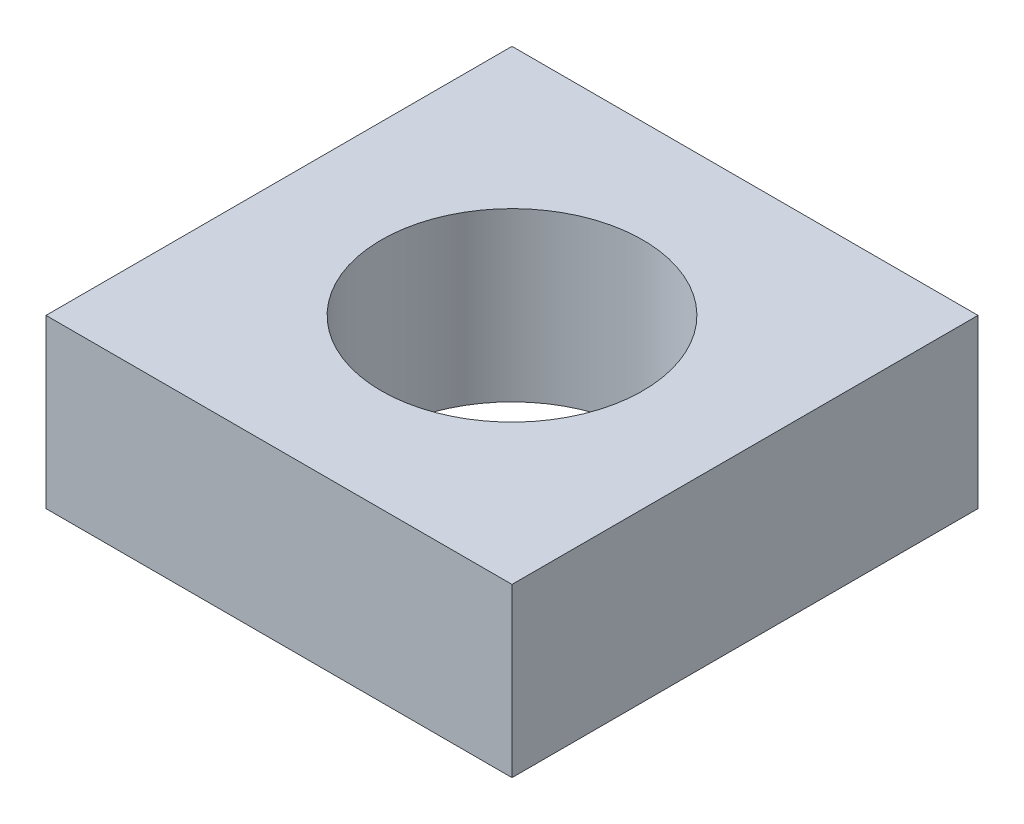
from build123d import *

# Parameters (mm, degrees)
SZKIC1_W                    = 4.454772721
SZKIC1_H                    = 4.454772721
SZKIC1_R                    = 1.25
DODANIE_WYCI_GNI_CIE1_DEPTH = 1.6


with BuildPart() as part:
    # Szkic1 → Dodanie-wyciągnięcie1 (new body)
    with BuildSketch(Plane(origin=(0, 0, 0), x_dir=(1, 0, 0), z_dir=(0, 1, 0))):
        with Locations((2.227386361, 2.227386361)):
            Rectangle(SZKIC1_W, SZKIC1_H)
        with Locations(Location((2.227386361, 2.227386361, 0), (0, 0, 270))):
            Circle(SZKIC1_R, mode=Mode.SUBTRACT)
    extrude(amount=DODANIE_WYCI_GNI_CIE1_DEPTH)


solid = part.part
